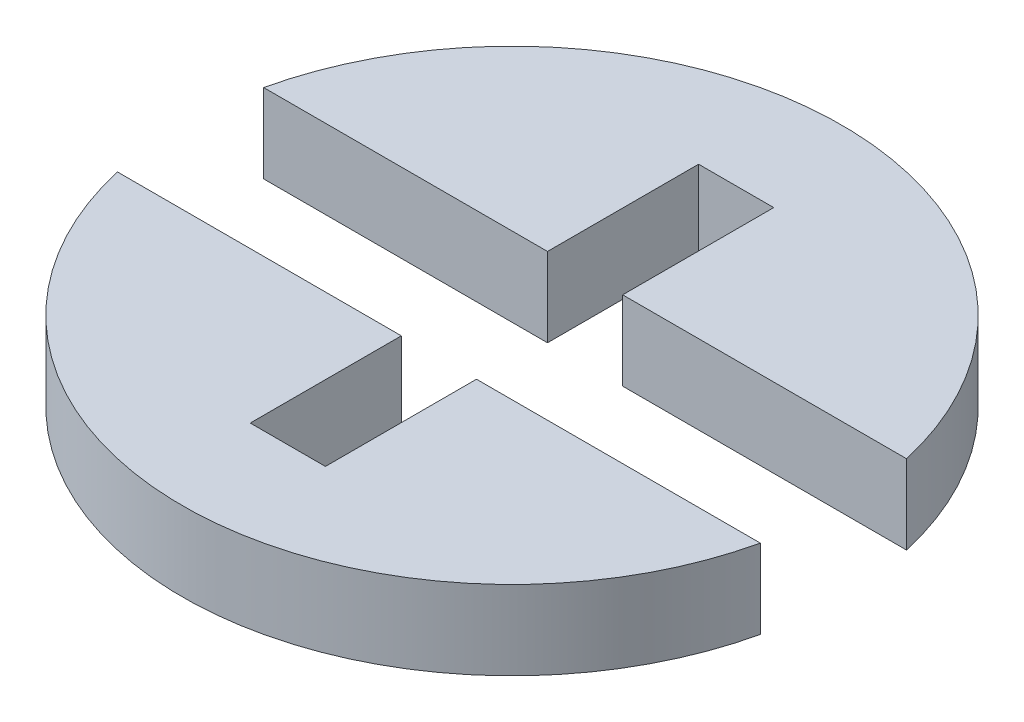
from build123d import *

# Parameters (mm, degrees)
BOSS_EXTRUDE1_DEPTH      = 1.5
BOSS_EXTRUDE1_DEPTH_BACK = 1.5
SKETCH1_R                = 12.5
SKETCH1_W                = 2.85
SKETCH1_H                = 17
CUT_EXTRUDE1_DEPTH       = 18.741194999
CUT_EXTRUDE1_DEPTH_BACK  = 18.741194999


with BuildPart() as part:
    # Sketch1 → Boss-Extrude1 (new, two sides: drawn at the far end of the back side and taken through both)
    with BuildSketch(Plane(origin=(0, 0, 0), x_dir=(1, 0, 0), z_dir=(0, 1, 0)).offset(-BOSS_EXTRUDE1_DEPTH_BACK)):
        Circle(SKETCH1_R)
        Rectangle(SKETCH1_W, SKETCH1_H, mode=Mode.SUBTRACT)
    extrude(amount=BOSS_EXTRUDE1_DEPTH + BOSS_EXTRUDE1_DEPTH_BACK)

    # Sketch4 → Cut-Extrude1 (cut, two sides: drawn at the far end of the back side and taken through both)
    with BuildSketch(Plane(origin=(0, 0, 0), x_dir=(0, 0, -1), z_dir=(1, 0, 0)).offset(-CUT_EXTRUDE1_DEPTH_BACK)):
        Polygon((2.771281292, -1.6), (2.771281292, 1.6), (0, 3.2), (-2.771281292, 1.6), (-2.771281292, -1.6), (0, -3.2), align=None)
    extrude(amount=CUT_EXTRUDE1_DEPTH + CUT_EXTRUDE1_DEPTH_BACK, mode=Mode.SUBTRACT)


with BuildPart() as cut_extrude1_piece_1:
    # of the separate pieces the step leaves, piece 1, a body of its own (cut_extrude1_pieces)
    add(part.part.solids().sort_by_distance((-12.188929403, -1.5, -2.771281292))[0])


with BuildPart() as cut_extrude1_piece_2:
    # of the separate pieces the step leaves, piece 2, a body of its own (cut_extrude1_pieces)
    add(part.part.solids().sort_by_distance((-12.188929403, 1.5, 2.771281292))[0])


solid = Compound([cut_extrude1_piece_1.part, cut_extrude1_piece_2.part])
